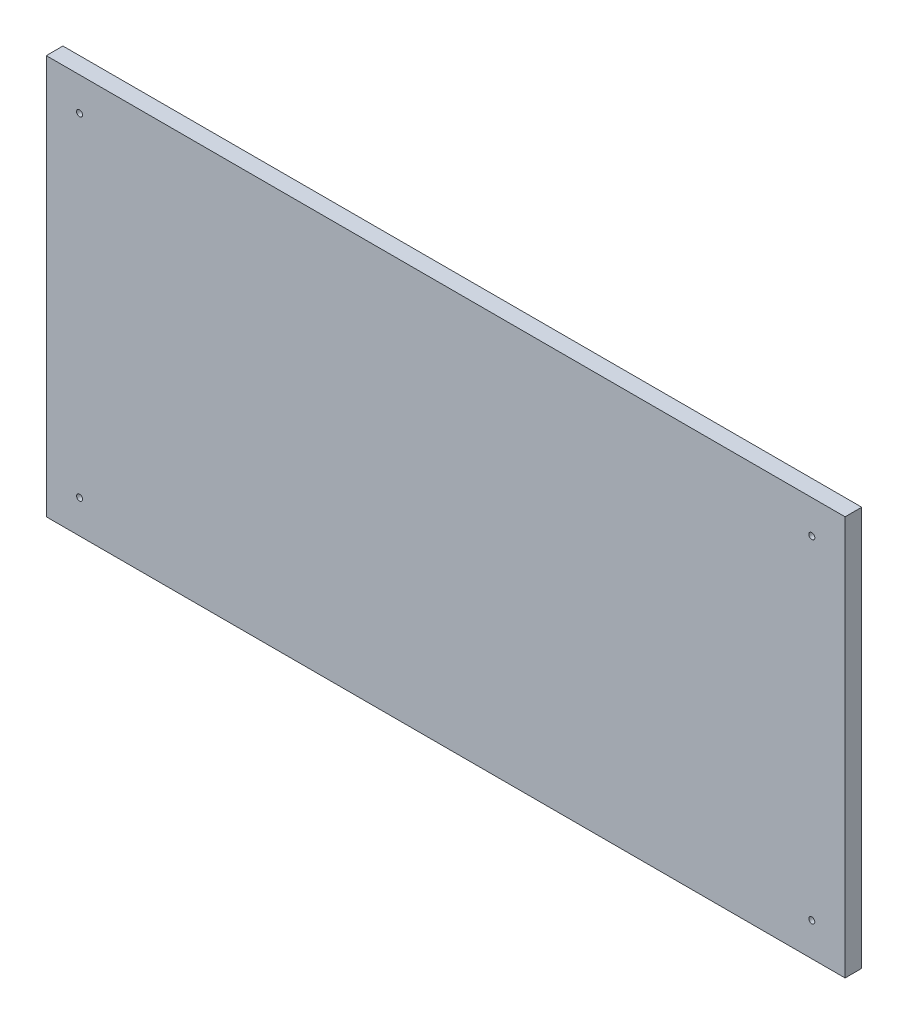
from build123d import *

# Parameters (mm, degrees)
SKETCH1_W           = 1200
SKETCH1_H           = 600
BOSS_EXTRUDE1_DEPTH = 25
SKETCH2_R           = 4.5
CUT_EXTRUDE1_DEPTH  = 26
SKETCH3_R           = 4.5
CUT_EXTRUDE2_DEPTH  = 26
SKETCH4_R           = 4.5
CUT_EXTRUDE3_DEPTH  = 26
SKETCH5_R           = 4.5
CUT_EXTRUDE4_DEPTH  = 26


with BuildPart() as part:
    # Sketch1 → Boss-Extrude1 (new body)
    with BuildSketch(Plane.XY):
        Rectangle(SKETCH1_W, SKETCH1_H)
    extrude(amount=BOSS_EXTRUDE1_DEPTH)

    # Sketch2 → Cut-Extrude1 (cut)
    with BuildSketch(Plane.XY):
        with Locations((-550, -250)):
            Circle(SKETCH2_R)
    extrude(amount=CUT_EXTRUDE1_DEPTH, mode=Mode.SUBTRACT)

    # Sketch3 → Cut-Extrude2 (cut)
    with BuildSketch(Plane.XY):
        with Locations((550, -250)):
            Circle(SKETCH3_R)
    extrude(amount=CUT_EXTRUDE2_DEPTH, mode=Mode.SUBTRACT)

    # Sketch4 → Cut-Extrude3 (cut)
    with BuildSketch(Plane.XY):
        with Locations((-550, 250)):
            Circle(SKETCH4_R)
    extrude(amount=CUT_EXTRUDE3_DEPTH, mode=Mode.SUBTRACT)

    # Sketch5 → Cut-Extrude4 (cut)
    with BuildSketch(Plane.XY):
        with Locations((550, 250)):
            Circle(SKETCH5_R)
    extrude(amount=CUT_EXTRUDE4_DEPTH, mode=Mode.SUBTRACT)


solid = part.part
